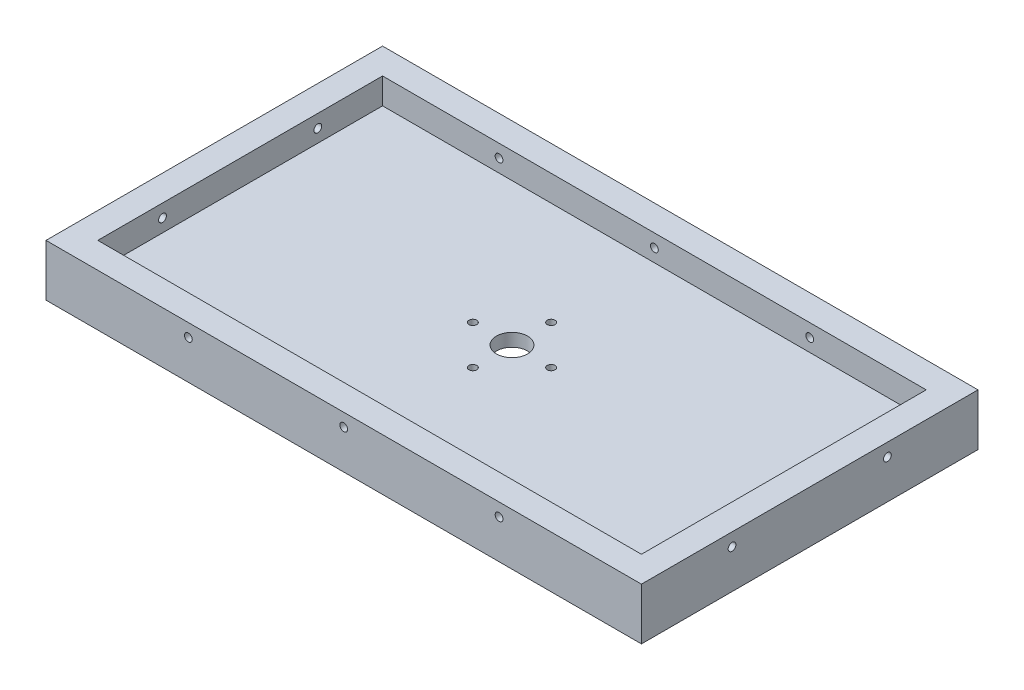
from build123d import *

# Parameters (mm, degrees)
SKETCH1_W           = 210
SKETCH1_H           = 110
BOSS_EXTRUDE1_DEPTH = 10
CUT_EXTRUDE1_DEPTH  = 5
SKETCH3_R           = 1.5
CUT_EXTRUDE2_DEPTH  = 5
SKETCH4_R           = 6
CUT_EXTRUDE3_DEPTH  = 5
SKETCH5_R           = 30
CUT_EXTRUDE4_DEPTH  = 5
SKETCH10_W          = 210
SKETCH10_H          = 110
BOSS_EXTRUDE2_DEPTH = 20
SKETCH11_R          = 1.5
CUT_EXTRUDE6_DEPTH  = 300
SKETCH12_R          = 1.5
CUT_EXTRUDE7_DEPTH  = 300


with BuildPart() as part:
    # Sketch1 → Boss-Extrude1 (new body)
    with BuildSketch(Plane(origin=(0, 0, 0), x_dir=(1, 0, 0), z_dir=(0, 1, 0))):
        with Locations((105, -55)):
            Rectangle(SKETCH1_W, SKETCH1_H)
    extrude(amount=BOSS_EXTRUDE1_DEPTH)

    # Sketch2 → Cut-Extrude1 (cut)
    with BuildSketch(Plane(origin=(0, 0, 0), x_dir=(-1, 0, 0), z_dir=(0, -1, 0))):
        with BuildLine():
            ThreePointArc((-130, -55), (-105, -80), (-80, -55))
            Line((-80, -55), (-130, -55))
        make_face()
        with BuildLine():
            Line((-130, -55), (-80, -55))
            ThreePointArc((-80, -55), (-105, -30), (-130, -55))
        make_face()
    extrude(amount=-CUT_EXTRUDE1_DEPTH, mode=Mode.SUBTRACT)

    # Sketch3 → Cut-Extrude2 (cut)
    with BuildSketch(Plane(origin=(0, 5, 0), x_dir=(-1, 0, 0), z_dir=(0, -1, 0))):
        with Locations(Location((-105, -70.12891571, 0), (0, 0, 90))):
            Circle(SKETCH3_R)
        with Locations(Location((-120.12891571, -55, 0), (0, 0, 90))):
            Circle(SKETCH3_R)
        with Locations(Location((-105, -39.87108429, 0), (0, 0, 90))):
            Circle(SKETCH3_R)
        with Locations(Location((-89.87108429, -55, 0), (0, 0, 90))):
            Circle(SKETCH3_R)
    extrude(amount=-CUT_EXTRUDE2_DEPTH, mode=Mode.SUBTRACT)

    # Sketch4 → Cut-Extrude3 (cut)
    with BuildSketch(Plane(origin=(0, 5, 0), x_dir=(-1, 0, 0), z_dir=(0, -1, 0))):
        with Locations(Location((-105, -55, 0), (0, 0, 90))):
            Circle(SKETCH4_R)
    extrude(amount=-CUT_EXTRUDE3_DEPTH, mode=Mode.SUBTRACT)

    # Sketch5 → Cut-Extrude4 (cut)
    with BuildSketch(Plane(origin=(0, 0, 0), x_dir=(-1, 0, 0), z_dir=(0, -1, 0))):
        with Locations(Location((-105, -55, 0), (0, 0, 90))):
            Circle(SKETCH5_R)
    extrude(amount=-CUT_EXTRUDE4_DEPTH, mode=Mode.SUBTRACT)

    # Sketch10 → Boss-Extrude2 (add)
    with BuildSketch(Plane(origin=(0, 0, 0), x_dir=(-1, 0, 0), z_dir=(0, -1, 0))):
        Polygon((10, -110), (10, 10), (-220, 10), (-220, -120), (10, -120), align=None)
        with Locations((-105, -55)):
            Rectangle(SKETCH10_W, SKETCH10_H, mode=Mode.SUBTRACT)
    extrude(amount=-BOSS_EXTRUDE2_DEPTH)

    # Sketch11 → Cut-Extrude6 (cut)
    with BuildSketch(Plane.ZY.offset(10)):
        with Locations((25, 15)):
            Circle(SKETCH11_R)
        with Locations((85, 15)):
            Circle(SKETCH11_R)
    extrude(amount=-CUT_EXTRUDE6_DEPTH, mode=Mode.SUBTRACT)

    # Sketch12 → Cut-Extrude7 (cut)
    with BuildSketch(Plane.XY.offset(120)):
        with Locations(Location((45, 15, 0), (0, 0, 180))):
            Circle(SKETCH12_R)
        with Locations(Location((165, 15, 0), (0, 0, 180))):
            Circle(SKETCH12_R)
        with Locations(Location((105, 15, 0), (0, 0, 180))):
            Circle(SKETCH12_R)
    extrude(amount=-CUT_EXTRUDE7_DEPTH, mode=Mode.SUBTRACT)


solid = part.part
